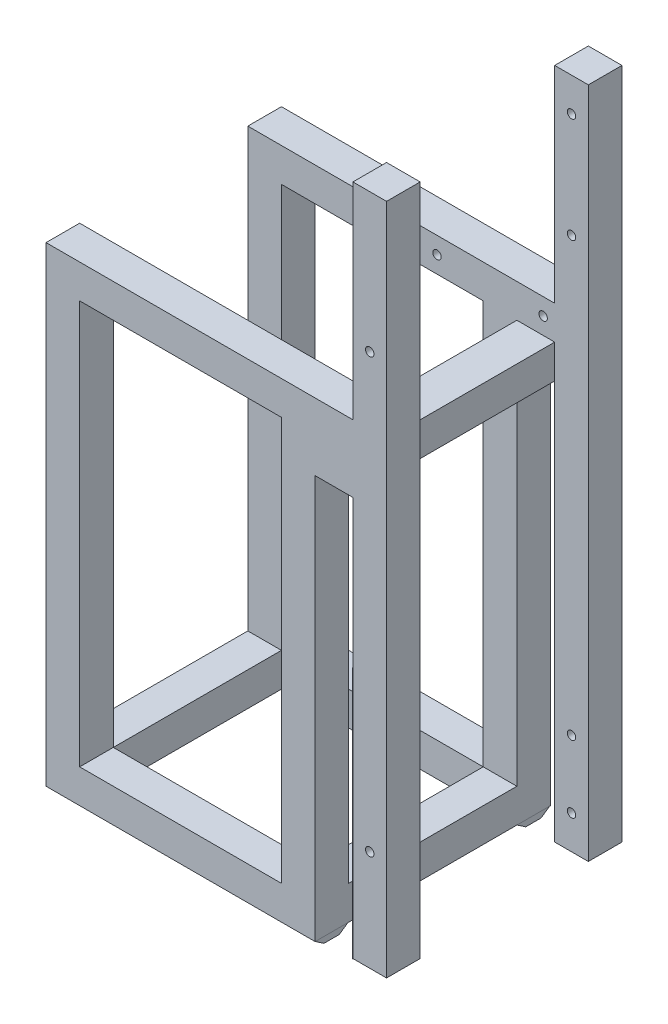
from build123d import *

# Parameters (mm, degrees)
SKETCH1_W               = 152.4
SKETCH1_H               = 304.8
BOSS_EXTRUDE1_DEPTH     = 177.8
SKETCH2_W               = 231.775
SKETCH2_H               = 127
CUT_EXTRUDE1_DEPTH      = 25.4
SKETCH3_W               = 127
SKETCH3_H               = 304.8
CUT_EXTRUDE2_DEPTH      = 25.4
SKETCH4_W               = 127
SKETCH4_H               = 304.8
CUT_EXTRUDE3_DEPTH      = 25.4
SKETCH5_W               = 152.4
SKETCH5_H               = 127
CUT_EXTRUDE4_DEPTH      = 25.4
SKETCH6_W               = 127
SKETCH6_H               = 508
CUT_EXTRUDE5_DEPTH      = 25.4
CUT_EXTRUDE6_REACH      = 429.606
SKETCH7_R               = 3.175
CUT_EXTRUDE7_DEPTH      = 139.7
CUT_EXTRUDE7_DEPTH_BACK = 12.7
SKETCH8_R               = 3.175
BOSS_EXTRUDE2_START     = -0.254
BOSS_EXTRUDE2_DEPTH     = 202.692
BOSS_EXTRUDE3_START     = 0.254
BOSS_EXTRUDE3_DEPTH     = 190.5
BOSS_EXTRUDE3_2_DEPTH   = 190.5


with BuildPart() as part:
    # Sketch1 → Boss-Extrude1 (new body)
    with BuildSketch(Plane.XY):
        Polygon((-73.503424658, -168.394429721), (129.696575342, -168.394429721), (129.696575342, 136.405570279), (158.271575342, 136.405570279), (158.271575342, -165.219429721), (183.671575342, -165.219429721), (183.671575342, 342.780570279), (158.271575342, 342.780570279), (158.271575342, 187.205570279), (-73.503424658, 187.205570279), align=None)
        with Locations((28.096575342, 9.405570279)):
            Rectangle(SKETCH1_W, SKETCH1_H, mode=Mode.SUBTRACT)
    extrude(amount=BOSS_EXTRUDE1_DEPTH)

    # Sketch2 → Cut-Extrude1 (cut)
    with BuildSketch(Plane(origin=(0, 187.205570279, 0), x_dir=(1, 0, 0), z_dir=(0, 1, 0))):
        with Locations((42.384075342, -88.9)):
            Rectangle(SKETCH2_W, SKETCH2_H)
    extrude(amount=-CUT_EXTRUDE1_DEPTH, mode=Mode.SUBTRACT)

    # Sketch3 → Cut-Extrude2 (cut)
    with BuildSketch(Plane.ZY.offset(73.503424658)):
        with Locations((88.9, 9.405570279)):
            Rectangle(SKETCH3_W, SKETCH3_H)
    extrude(amount=-CUT_EXTRUDE2_DEPTH, mode=Mode.SUBTRACT)

    # Sketch4 → Cut-Extrude3 (cut)
    with BuildSketch(Plane.ZY.offset(-104.296575342)):
        with Locations((88.9, 9.405570279)):
            Rectangle(SKETCH4_W, SKETCH4_H)
    extrude(amount=-CUT_EXTRUDE3_DEPTH, mode=Mode.SUBTRACT)

    # Sketch5 → Cut-Extrude4 (cut)
    with BuildSketch(Plane(origin=(0, -142.994429721, 0), x_dir=(1, 0, 0), z_dir=(0, 1, 0))):
        with Locations((28.096575342, -88.9)):
            Rectangle(SKETCH5_W, SKETCH5_H)
    extrude(amount=-CUT_EXTRUDE4_DEPTH, mode=Mode.SUBTRACT)

    # Sketch6 → Cut-Extrude5 (cut)
    with BuildSketch(Plane(origin=(183.671575342, 0, 0), x_dir=(0, 0, -1), z_dir=(1, 0, 0))):
        with Locations((-88.9, 88.780570279)):
            Rectangle(SKETCH6_W, SKETCH6_H)
    extrude(amount=-CUT_EXTRUDE5_DEPTH, mode=Mode.SUBTRACT)

    # Cut-Extrude6: up to this face of the body (flat: up to its plane)
    cut_extrude6_end = Plane(part.part.faces().sort_by_distance((28.096575342, -162.672202347, 0))[0])
    # Sketch7 → Cut-Extrude6 (cut, up to the picked face)
    with BuildSketch(Plane.XY.offset(177.8), mode=Mode.PRIVATE) as cut_extrude6_sk1:
        with Locations((170.971575342, 238.005570279)):
            Circle(SKETCH7_R)
    cut_extrude6_tool1 = split(extrude(cut_extrude6_sk1.sketch, amount=-CUT_EXTRUDE6_REACH, mode=Mode.PRIVATE), bisect_by=cut_extrude6_end, keep=Keep.BOTH, mode=Mode.PRIVATE)
    # Sketch7 → Cut-Extrude6 (cut, up to the picked face)
    with BuildSketch(Plane.XY.offset(177.8), mode=Mode.PRIVATE) as cut_extrude6_sk2:
        with Locations((170.971575342, -89.019429721)):
            Circle(SKETCH7_R)
    cut_extrude6_tool2 = split(extrude(cut_extrude6_sk2.sketch, amount=-CUT_EXTRUDE6_REACH, mode=Mode.PRIVATE), bisect_by=cut_extrude6_end, keep=Keep.BOTH, mode=Mode.PRIVATE)
    add(cut_extrude6_tool1.solids().sort_by(Axis((170.971575, 238.00557, 177.8), (0, 0, -1)))[0], mode=Mode.SUBTRACT)
    add(cut_extrude6_tool2.solids().sort_by(Axis((170.971575, -89.01943, 177.8), (0, 0, -1)))[0], mode=Mode.SUBTRACT)

    # Sketch8 → Cut-Extrude7 (cut, two sides: drawn at the far end of the back side and taken through both)
    with BuildSketch(Plane(origin=(0, 0, 152.4), x_dir=(-1, 0, 0), z_dir=(0, 0, -1)).offset(-CUT_EXTRUDE7_DEPTH_BACK)):
        with Locations(Location((-69.371575342, 174.505570279, 0), (0, 0, 180))):
            Circle(SKETCH8_R)
        with Locations(Location((-170.971575342, 317.380570279, 0), (0, 0, 180))):
            Circle(SKETCH8_R)
        with Locations(Location((-170.971575342, -139.819429721, 0), (0, 0, 180))):
            Circle(SKETCH8_R)
        with Locations(Location((-149.540325342, 174.505570279, 0), (0, 0, 180))):
            Circle(SKETCH8_R)
    extrude(amount=CUT_EXTRUDE7_DEPTH + CUT_EXTRUDE7_DEPTH_BACK, mode=Mode.SUBTRACT)

    # Sketch10 → Boss-Extrude2 (add)
    with BuildSketch(Plane.ZY.offset(73.503424658).offset(BOSS_EXTRUDE2_START)):
        Polygon((177.8, -168.394429721), (152.4, -168.394429721), (159.327401487, -173.156929721), (170.872598513, -173.156929721), align=None)
    boss_extrude2 = extrude(amount=-BOSS_EXTRUDE2_DEPTH)

    # Mirror1: Boss-Extrude2 across plane
    add(boss_extrude2.mirror(Plane.XY.offset(88.9)))


with BuildPart() as body_2:
    # Sketch11 → Boss-Extrude3 (new body)
    with BuildSketch(Plane.XZ.offset(165.219429721).offset(BOSS_EXTRUDE3_START)):
        Polygon((158.271575342, 152.4), (158.117080653, 177.799530141), (153.39680445, 170.843289046), (153.467027742, 159.298305587), align=None)
    extrude(amount=-BOSS_EXTRUDE3_DEPTH)


with BuildPart() as body_3:
    # Sketch11 → Boss-Extrude3 2 (new body)
    with BuildSketch(Plane.XZ.offset(165.219429721).offset(BOSS_EXTRUDE3_START)):
        Polygon((158.271575342, 0), (158.117080653, 25.399530141), (153.39680445, 18.443289046), (153.467027742, 6.898305587), align=None)
    extrude(amount=-BOSS_EXTRUDE3_2_DEPTH)


solid = Compound([part.part, body_2.part, body_3.part])
